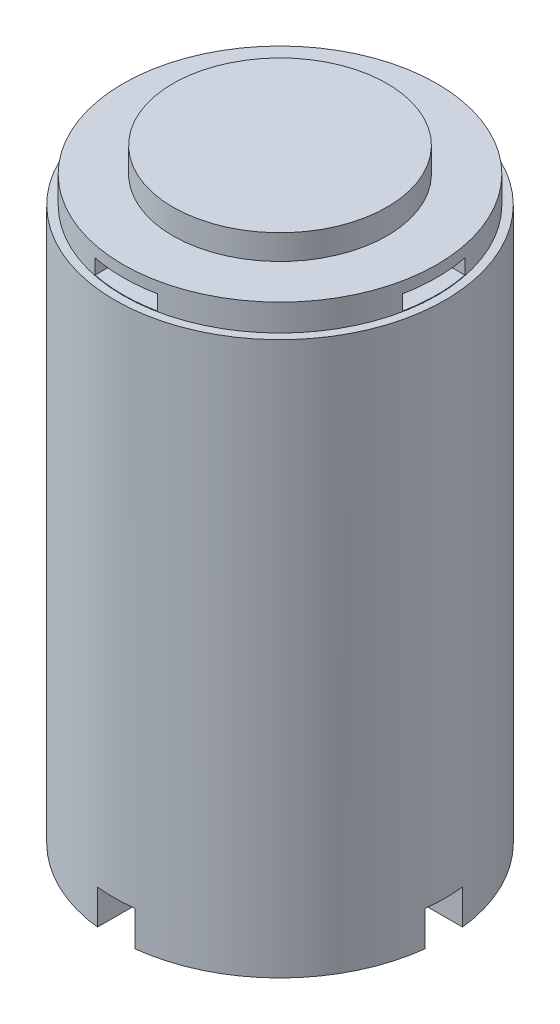
from build123d import *

# Parameters (mm, degrees)
SKETCH1_R           = 1682.75
BOSS_EXTRUDE1_DEPTH = 5588
SKETCH2_R           = 1600.2
BOSS_EXTRUDE2_DEPTH = 273.05
SKETCH3_R           = 1092.2
BOSS_EXTRUDE3_DEPTH = 254
SKETCH4_W           = 381
SKETCH4_H           = 304.8
CUT_EXTRUDE1_DEPTH  = 7180.97731995
CIRPATTERN1_COUNT   = 2
CIRPATTERN1_ANGLE   = 90
SKETCH5_W           = 635
SKETCH5_H           = 152.4
CUT_EXTRUDE2_DEPTH  = 7180.97731995
CIRPATTERN2_COUNT   = 2
CIRPATTERN2_ANGLE   = 90
BOSS_EXTRUDE4_START = 50.8
BOSS_EXTRUDE4_DEPTH = 50.8


with BuildPart() as part:
    # Sketch1 → Boss-Extrude1 (new body)
    with BuildSketch(Plane(origin=(0, 0, 0), x_dir=(1, 0, 0), z_dir=(0, 1, 0))):
        with Locations(Location((0, 0, 0), (0, 0, 270))):
            Circle(SKETCH1_R)
    extrude(amount=BOSS_EXTRUDE1_DEPTH)

    # Sketch2 → Boss-Extrude2 (add)
    with BuildSketch(Plane(origin=(0, 5588, 0), x_dir=(1, 0, 0), z_dir=(0, 1, 0))):
        with Locations(Location((0, 0, 0), (0, 0, 270))):
            Circle(SKETCH2_R)
    extrude(amount=BOSS_EXTRUDE2_DEPTH)

    # Sketch3 → Boss-Extrude3 (add)
    with BuildSketch(Plane(origin=(0, 5861.05, 0), x_dir=(1, 0, 0), z_dir=(0, 1, 0))):
        with Locations(Location((0, 0, 0), (0, 0, 270))):
            Circle(SKETCH3_R)
    extrude(amount=BOSS_EXTRUDE3_DEPTH)

    # Sketch4 → Cut-Extrude1 (cut, through all)
    with BuildSketch(Plane.ZY.offset(1682.75)):
        with Locations((0, 152.4)):
            Rectangle(SKETCH4_W, SKETCH4_H)
    cut_extrude1 = extrude(amount=-CUT_EXTRUDE1_DEPTH, mode=Mode.SUBTRACT)

    # CirPattern1: Cut-Extrude1 ×2 about axis
    cirpattern1_axis = Axis((0, 5588, 0), (0, -1, 0))
    for i in range(1, CIRPATTERN1_COUNT):
        add(cut_extrude1.rotate(cirpattern1_axis, i * CIRPATTERN1_ANGLE / (CIRPATTERN1_COUNT - 1)), mode=Mode.SUBTRACT)

    # Sketch5 → Cut-Extrude2 (cut, through all)
    with BuildSketch(Plane.ZY.offset(1682.75)):
        with Locations((0, 5670.55)):
            Rectangle(SKETCH5_W, SKETCH5_H)
    cut_extrude2 = extrude(amount=-CUT_EXTRUDE2_DEPTH, mode=Mode.SUBTRACT)

    # CirPattern2: Cut-Extrude2 ×2 about axis
    cirpattern2_axis = Axis((0, 5588, 0), (0, -1, 0))
    for i in range(1, CIRPATTERN2_COUNT):
        add(cut_extrude2.rotate(cirpattern2_axis, i * CIRPATTERN2_ANGLE / (CIRPATTERN2_COUNT - 1)), mode=Mode.SUBTRACT)

    # Sketch6 → Boss-Extrude4 (add)
    with BuildSketch(Plane.XZ.offset(BOSS_EXTRUDE4_START)):
        with BuildLine():
            Line((-190.5, 1671.932209302), (-190.5, 1294.15430301))
            ThreePointArc((-190.5, 1294.15430301), (0, 1308.1), (190.5, 1294.15430301))
            Line((190.5, 1294.15430301), (190.5, 1671.932209302))
            ThreePointArc((190.5, 1671.932209302), (1189.883936042, 1189.883936042), (1671.932209302, 190.5))
            Line((1671.932209302, 190.5), (1294.15430301, 190.5))
            ThreePointArc((1294.15430301, 190.5), (1308.1, 0), (1294.15430301, -190.5))
            Line((1294.15430301, -190.5), (1671.932209302, -190.5))
            ThreePointArc((1671.932209302, -190.5), (1189.883936042, -1189.883936042), (190.5, -1671.932209302))
            Line((190.5, -1671.932209302), (190.5, -1294.15430301))
            ThreePointArc((190.5, -1294.15430301), (0, -1308.1), (-190.5, -1294.15430301))
            Line((-190.5, -1294.15430301), (-190.5, -1671.932209302))
            ThreePointArc((-190.5, -1671.932209302), (-1189.883936042, -1189.883936042), (-1671.932209302, -190.5))
            Line((-1671.932209302, -190.5), (-1294.15430301, -190.5))
            ThreePointArc((-1294.15430301, -190.5), (-1308.1, 0), (-1294.15430301, 190.5))
            Line((-1294.15430301, 190.5), (-1671.932209302, 190.5))
            ThreePointArc((-1671.932209302, 190.5), (-1189.883936042, 1189.883936042), (-190.5, 1671.932209302))
        make_face()
    extrude(amount=-BOSS_EXTRUDE4_DEPTH)


solid = part.part
